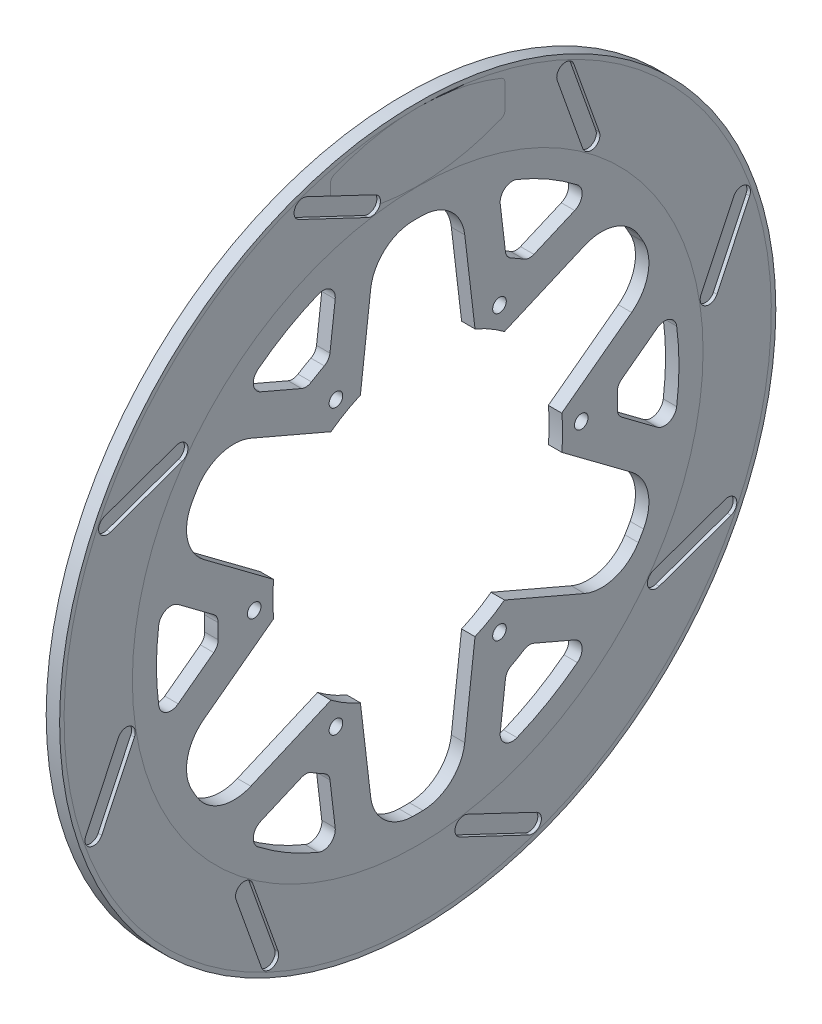
from build123d import *

# Parameters (mm, degrees)
SKETCH1_R                = 127
SKETCH1_R_2              = 2.413
SKETCH1_R_3              = 51.435
BOSS_EXTRUDE1_DEPTH      = 4.7625
CUT_EXTRUDE7_DEPTH       = 1.27
CUT_EXTRUDE8_DEPTH       = 1.27
CUT_EXTRUDE_V1_DEPTH     = 180.668253752
FILLET7_R                = 15.24
CIRPATTERN2_COUNT        = 6
FILLET7_OF_CIRPATTERN2_R = 15.24
CUT_EXTRUDE10_DEPTH      = 180.668253752
CIRPATTERN3_COUNT        = 6


with BuildPart() as part:
    # Sketch1 → Boss-Extrude1 (new body)
    with BuildSketch(Plane.ZY):
        with Locations(Location((0, 0, 0), (0, 0, 180))):
            Circle(SKETCH1_R)
        with Locations(Location((29, 50.229473419, 0), (0, 0, 180))):
            Circle(SKETCH1_R_2, mode=Mode.SUBTRACT)
        with Locations(Location((-58, 0, 0), (0, 0, 180))):
            Circle(SKETCH1_R_2, mode=Mode.SUBTRACT)
        with Locations(Location((58, 0, 0), (0, 0, 180))):
            Circle(SKETCH1_R_2, mode=Mode.SUBTRACT)
        with Locations(Location((-29, -50.229473419, 0), (0, 0, 180))):
            Circle(SKETCH1_R_2, mode=Mode.SUBTRACT)
        with Locations(Location((29, -50.229473419, 0), (0, 0, 180))):
            Circle(SKETCH1_R_2, mode=Mode.SUBTRACT)
        with Locations(Location((-29, 50.229473419, 0), (0, 0, 180))):
            Circle(SKETCH1_R_2, mode=Mode.SUBTRACT)
        with Locations(Location((0, 0, 0), (0, 0, 180))):
            Circle(SKETCH1_R_3, mode=Mode.SUBTRACT)
    extrude(amount=BOSS_EXTRUDE1_DEPTH)

    # Sketch28 → Cut-Extrude7 (cut)
    with BuildSketch(Plane.ZY.offset(4.7625)):
        with BuildLine():
            Line((59.878651859, 89.366188672), (83.584074753, 91.214408084))
            ThreePointArc((83.584074753, 91.214408084), (86.345018146, 88.85284644), (83.983456502, 86.091903048))
            Line((83.983456502, 86.091903048), (60.278033608, 84.243683636))
            ThreePointArc((60.278033608, 84.243683636), (57.517090215, 86.605245279), (59.878651859, 89.366188672))
        make_face()
        with BuildLine():
            Line((-20.850837241, 105.532038797), (-5.395460441, 123.601192555))
            ThreePointArc((-5.395460441, 123.601192555), (-1.773302393, 123.883598098), (-1.49089685, 120.26144005))
            Line((-1.49089685, 120.26144005), (-16.94627365, 102.192286292))
            ThreePointArc((-16.94627365, 102.192286292), (-20.568431698, 101.909880749), (-20.850837241, 105.532038797))
        make_face()
        with BuildLine():
            Line((105.532038797, 20.850837241), (123.601192555, 5.395460441))
            ThreePointArc((123.601192555, 5.395460441), (123.883598098, 1.773302393), (120.26144005, 1.49089685))
            Line((120.26144005, 1.49089685), (102.192286292, 16.94627365))
            ThreePointArc((102.192286292, 16.94627365), (101.909880749, 20.568431698), (105.532038797, 20.850837241))
        make_face()
        with BuildLine():
            Line((89.366188672, -59.878651859), (91.214408084, -83.584074753))
            ThreePointArc((91.214408084, -83.584074753), (88.85284644, -86.345018146), (86.091903048, -83.983456502))
            Line((86.091903048, -83.983456502), (84.243683636, -60.278033608))
            ThreePointArc((84.243683636, -60.278033608), (86.605245279, -57.517090215), (89.366188672, -59.878651859))
        make_face()
        with BuildLine():
            Line((20.850837241, -105.532038797), (5.395460441, -123.601192555))
            ThreePointArc((5.395460441, -123.601192555), (1.773302393, -123.883598098), (1.49089685, -120.26144005))
            Line((1.49089685, -120.26144005), (16.94627365, -102.192286292))
            ThreePointArc((16.94627365, -102.192286292), (20.568431698, -101.909880749), (20.850837241, -105.532038797))
        make_face()
        with BuildLine():
            Line((-59.878651859, -89.366188672), (-83.584074753, -91.214408084))
            ThreePointArc((-83.584074753, -91.214408084), (-86.345018146, -88.85284644), (-83.983456502, -86.091903048))
            Line((-83.983456502, -86.091903048), (-60.278033608, -84.243683636))
            ThreePointArc((-60.278033608, -84.243683636), (-57.517090215, -86.605245279), (-59.878651859, -89.366188672))
        make_face()
        with BuildLine():
            Line((-105.532038797, -20.850837241), (-123.601192555, -5.395460441))
            ThreePointArc((-123.601192555, -5.395460441), (-123.883598098, -1.773302393), (-120.26144005, -1.49089685))
            Line((-120.26144005, -1.49089685), (-102.192286292, -16.94627365))
            ThreePointArc((-102.192286292, -16.94627365), (-101.909880749, -20.568431698), (-105.532038797, -20.850837241))
        make_face()
        with BuildLine():
            Line((-89.366188672, 59.878651859), (-91.214408084, 83.584074753))
            ThreePointArc((-91.214408084, 83.584074753), (-88.85284644, 86.345018146), (-86.091903048, 83.983456502))
            Line((-86.091903048, 83.983456502), (-84.243683636, 60.278033608))
            ThreePointArc((-84.243683636, 60.278033608), (-86.605245279, 57.517090215), (-89.366188672, 59.878651859))
        make_face()
    extrude(amount=-CUT_EXTRUDE7_DEPTH, mode=Mode.SUBTRACT)

    # Sketch29 → Cut-Extrude8 (cut)
    with BuildSketch(Plane(origin=(0, 0, 0), x_dir=(0, 0, -1), z_dir=(1, 0, 0))):
        with BuildLine():
            Line((55.380822463, 111.083430749), (64.432003181, 85.652835897))
            ThreePointArc((64.432003181, 85.652835897), (62.533231094, 81.655560266), (58.535955464, 83.554332353))
            Line((58.535955464, 83.554332353), (49.484774746, 108.984927206))
            ThreePointArc((49.484774746, 108.984927206), (51.383546832, 112.982202836), (55.380822463, 111.083430749))
        make_face()
        with BuildLine():
            Line((117.708002272, 39.387692049), (106.126007465, 15.005394716))
            ThreePointArc((106.126007465, 15.005394716), (101.956872142, 13.52152863), (100.473006056, 17.690663953))
            Line((100.473006056, 17.690663953), (112.055000862, 42.072961286))
            ThreePointArc((112.055000862, 42.072961286), (116.224136186, 43.556827372), (117.708002272, 39.387692049))
        make_face()
        with BuildLine():
            Line((111.083430749, -55.380822463), (85.652835897, -64.432003181))
            ThreePointArc((85.652835897, -64.432003181), (81.655560266, -62.533231094), (83.554332353, -58.535955464))
            Line((83.554332353, -58.535955464), (108.984927206, -49.484774746))
            ThreePointArc((108.984927206, -49.484774746), (112.982202836, -51.383546832), (111.083430749, -55.380822463))
        make_face()
        with BuildLine():
            Line((39.387692049, -117.708002272), (15.005394716, -106.126007465))
            ThreePointArc((15.005394716, -106.126007465), (13.52152863, -101.956872142), (17.690663953, -100.473006056))
            Line((17.690663953, -100.473006056), (42.072961286, -112.055000862))
            ThreePointArc((42.072961286, -112.055000862), (43.556827372, -116.224136186), (39.387692049, -117.708002272))
        make_face()
        with BuildLine():
            Line((-55.380822463, -111.083430749), (-64.432003181, -85.652835897))
            ThreePointArc((-64.432003181, -85.652835897), (-62.533231094, -81.655560266), (-58.535955464, -83.554332353))
            Line((-58.535955464, -83.554332353), (-49.484774745, -108.984927206))
            ThreePointArc((-49.484774745, -108.984927206), (-51.383546832, -112.982202836), (-55.380822463, -111.083430749))
        make_face()
        with BuildLine():
            Line((-117.708002272, -39.387692049), (-106.126007465, -15.005394716))
            ThreePointArc((-106.126007465, -15.005394716), (-101.956872142, -13.52152863), (-100.473006056, -17.690663953))
            Line((-100.473006056, -17.690663953), (-112.055000862, -42.072961286))
            ThreePointArc((-112.055000862, -42.072961286), (-116.224136186, -43.556827372), (-117.708002272, -39.387692049))
        make_face()
        with BuildLine():
            Line((-111.083430749, 55.380822463), (-85.652835897, 64.432003181))
            ThreePointArc((-85.652835897, 64.432003181), (-81.655560266, 62.533231094), (-83.554332353, 58.535955464))
            Line((-83.554332353, 58.535955464), (-108.984927206, 49.484774746))
            ThreePointArc((-108.984927206, 49.484774746), (-112.982202836, 51.383546832), (-111.083430749, 55.380822463))
        make_face()
        with BuildLine():
            Line((-39.387692049, 117.708002272), (-15.005394716, 106.126007465))
            ThreePointArc((-15.005394716, 106.126007465), (-13.52152863, 101.956872142), (-17.690663953, 100.473006056))
            Line((-17.690663953, 100.473006056), (-42.072961286, 112.055000862))
            ThreePointArc((-42.072961286, 112.055000862), (-43.556827372, 116.224136186), (-39.387692049, 117.708002272))
        make_face()
    extrude(amount=-CUT_EXTRUDE8_DEPTH, mode=Mode.SUBTRACT)

    # Sketch31 → Cut-Extrude v1 (cut, through all)
    with BuildSketch(Plane.ZY.offset(4.7625)):
        with BuildLine():
            Line((-15.24, 90.161055894), (-20.32, 47.250998138))
            ThreePointArc((-20.32, 47.250998138), (0, 51.435), (20.32, 47.250998138))
            Line((20.32, 47.250998138), (15.24, 90.161055894))
            ThreePointArc((15.24, 90.161055894), (0, 91.44), (-15.24, 90.161055894))
        make_face()
    cut_extrude_v1 = extrude(amount=-CUT_EXTRUDE_V1_DEPTH, mode=Mode.SUBTRACT)

    # Fillet7
    fillet7_edges = [part.edges().sort_by_distance(p)[0] for p in [
        (-2.38125, 90.161055894, -15.24),
        (-2.38125, 90.161055894, 15.24),
    ]]
    fillet(fillet7_edges, radius=FILLET7_R)

    # CirPattern2: Cut-Extrude v1 ×6 about axis
    cirpattern2_axis = Axis((0, 0, 0), (1, 0, 0))
    for i in range(1, CIRPATTERN2_COUNT):
        add(cut_extrude_v1.rotate(cirpattern2_axis, i * 360 / CIRPATTERN2_COUNT), mode=Mode.SUBTRACT)

    # Fillet7 of CirPattern2
    fillet7_of_cirpattern2_edges = [part.edges().sort_by_distance(p)[0] for p in [
        (-2.38125, 58.278755101, 70.461764837),
        (-2.38125, 31.882300794, 85.701764837),
        (-2.38125, -31.882300794, 85.701764837),
        (-2.38125, -58.278755101, 70.461764837),
        (-2.38125, -90.161055894, 15.24),
        (-2.38125, -90.161055894, -15.24),
        (-2.38125, -58.278755101, -70.461764837),
        (-2.38125, -31.882300794, -85.701764837),
        (-2.38125, 31.882300794, -85.701764837),
        (-2.38125, 58.278755101, -70.461764837),
    ]]
    fillet(fillet7_of_cirpattern2_edges, radius=FILLET7_OF_CIRPATTERN2_R)

    # Sketch34 → Cut-Extrude10 (cut, through all)
    with BuildSketch(Plane.ZY.offset(4.7625)):
        with BuildLine():
            Line((-55.679733454, 65.93893339), (-41.20758482, 59.721704072))
            ThreePointArc((-41.20758482, 59.721704072), (-39.408742963, 59.423777508), (-37.677457275, 59.995828318))
            ThreePointArc((-37.677457275, 59.995828318), (-35.422768816, 61.354035333), (-33.119182807, 62.627549309))
            ThreePointArc((-33.119182807, 62.627549309), (-31.758129429, 63.840861291), (-31.116720474, 65.547667319))
            Line((-31.116720474, 65.547667319), (-29.264924687, 81.189530343))
            ThreePointArc((-29.264924687, 81.189530343), (-30.949042738, 85.15305578), (-35.219325197, 85.710258811))
            ThreePointArc((-35.219325197, 85.710258811), (-46.332087512, 80.249529591), (-56.617598896, 73.35595973))
            ThreePointArc((-56.617598896, 73.35595973), (-58.270188146, 69.379185124), (-55.679733454, 65.93893339))
        make_face()
    cut_extrude10 = extrude(amount=-CUT_EXTRUDE10_DEPTH, mode=Mode.SUBTRACT)

    # CirPattern3: Cut-Extrude10 ×6 about axis
    cirpattern3_axis = Axis((0, 0, 0), (1, 0, 0))
    for i in range(1, CIRPATTERN3_COUNT):
        add(cut_extrude10.rotate(cirpattern3_axis, i * 360 / CIRPATTERN3_COUNT), mode=Mode.SUBTRACT)


solid = part.part
